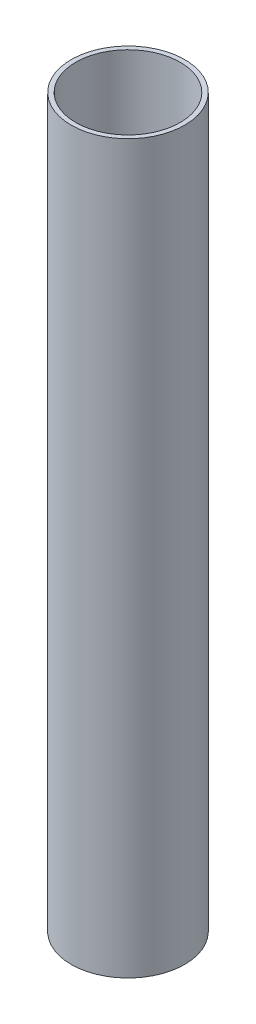
from build123d import *

# Parameters (mm, degrees)
SKETCH1_R           = 12.5
SKETCH1_R_2         = 11.5
BOSS_EXTRUDE1_DEPTH = 160


with BuildPart() as part:
    # Sketch1 → Boss-Extrude1 (new body)
    with BuildSketch(Plane(origin=(0, 0, 0), x_dir=(1, 0, 0), z_dir=(0, 1, 0))):
        with Locations(Location((0, 0, 0), (0, 0, 270))):
            Circle(SKETCH1_R)
        with Locations(Location((0, 0, 0), (0, 0, 270))):
            Circle(SKETCH1_R_2, mode=Mode.SUBTRACT)
    extrude(amount=BOSS_EXTRUDE1_DEPTH)


solid = part.part
